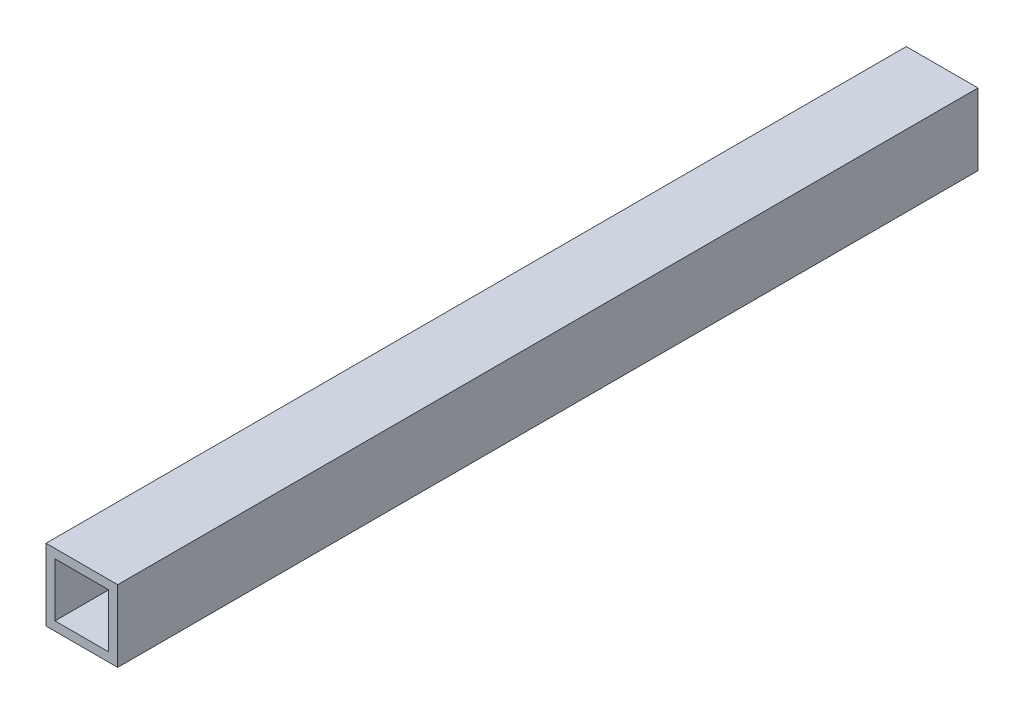
from build123d import *

# Parameters (mm, degrees)
SKETCH1_W           = 25.4
SKETCH1_H           = 25.4
SKETCH1_W_2         = 19.05
SKETCH1_H_2         = 19.05
BOSS_EXTRUDE1_DEPTH = 304.8


with BuildPart() as part:
    # Sketch1 → Boss-Extrude1 (new body)
    with BuildSketch(Plane.XY):
        with Locations((12.7, -12.7)):
            Rectangle(SKETCH1_W, SKETCH1_H)
        with Locations((12.7, -12.7)):
            Rectangle(SKETCH1_W_2, SKETCH1_H_2, mode=Mode.SUBTRACT)
    extrude(amount=BOSS_EXTRUDE1_DEPTH)


solid = part.part
